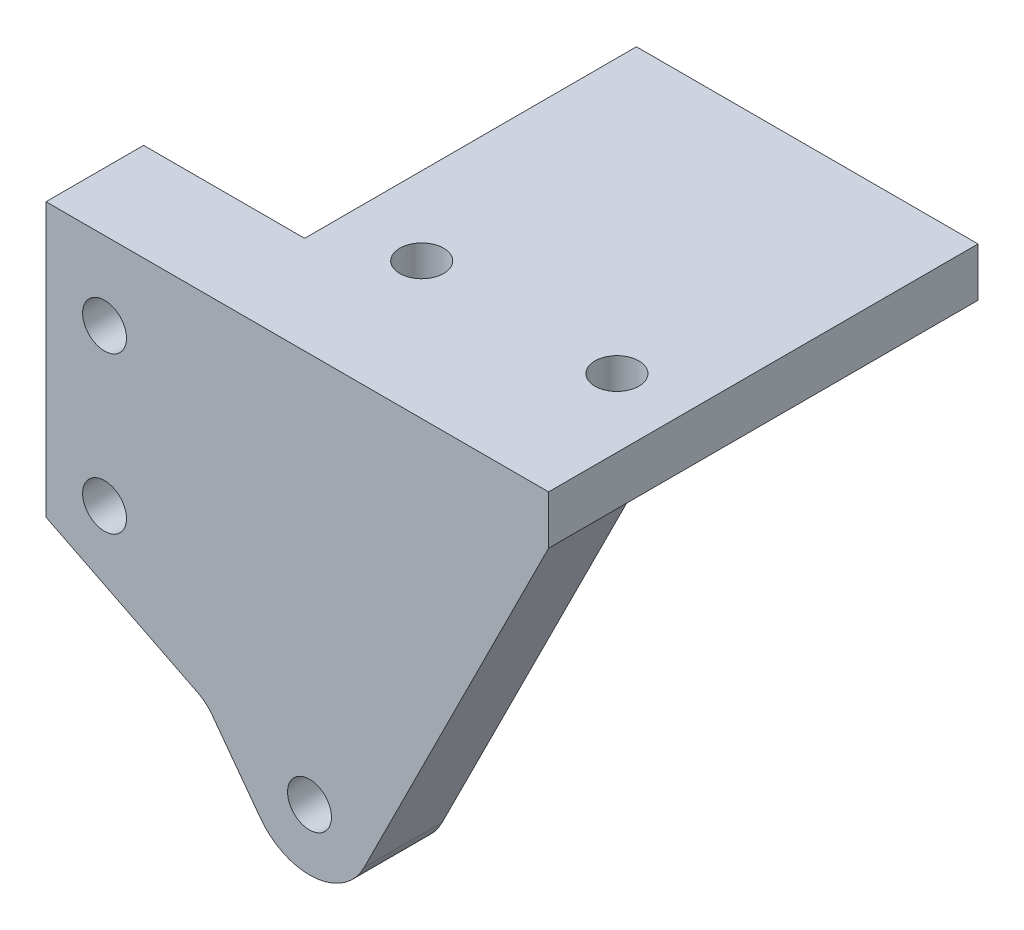
from build123d import *

# Parameters (mm, degrees)
BOSS_EXTRUDE1_DEPTH     = 28
BOSS_EXTRUDE2_DEPTH     = 12
SKETCH3_R               = 2.25
CUT_EXTRUDE1_DEPTH      = 62.565006294
SKETCH4_R               = 2.25
CUT_EXTRUDE2_DEPTH      = 56.554027757
SKETCH5_W               = 40
SKETCH5_H               = 5
BOSS_EXTRUDE3_DEPTH     = 25
CUT_EXTRUDE3_DEPTH      = 10
CUT_EXTRUDE3_DEPTH_BACK = 54.209491634
SKETCH6_R               = 2.25
SKETCH7_W               = 7
SKETCH7_H               = 5
CUT_EXTRUDE4_DEPTH      = 10
SKETCH8_R               = 2.25
BOSS_EXTRUDE4_DEPTH     = 8
BOSS_EXTRUDE6_DEPTH     = 4
SKETCH10_W              = 8
SKETCH10_H              = 28
CUT_EXTRUDE5_DEPTH      = 66.423619588


with BuildPart() as part:
    # Sketch1 → Boss-Extrude1 (new body)
    with BuildSketch(Plane(origin=(0, 0, 0), x_dir=(1, 0, 0), z_dir=(0, 1, 0))):
        Polygon((0, 0), (-26.5, 0), (-26.5, 10), (-10, 10), (-10, 40), (0, 40), align=None)
    extrude(amount=BOSS_EXTRUDE1_DEPTH)

    # Sketch2 → Boss-Extrude2 (add)
    with BuildSketch(Plane.ZY.offset(26.5)):
        with BuildLine():
            Line((0, 28), (0, 0))
            Line((0, 0), (8, 0))
            Line((8, 0), (8, 8))
            ThreePointArc((8, 8), (4, 12), (8, 16))
            Line((8, 16), (8, 28))
            Line((8, 28), (0, 28))
        make_face()
    extrude(amount=-BOSS_EXTRUDE2_DEPTH)

    # Sketch3 → Cut-Extrude1 (cut, through all)
    with BuildSketch(Plane.XY.offset(8)):
        with Locations((-20.5, 20)):
            Circle(SKETCH3_R)
        with Locations((-20.5, 4)):
            Circle(SKETCH3_R)
    extrude(amount=-CUT_EXTRUDE1_DEPTH, mode=Mode.SUBTRACT)

    # Sketch4 → Cut-Extrude2 (cut, through all)
    with BuildSketch(Plane(origin=(0, 0, 0), x_dir=(0, 0, -1), z_dir=(1, 0, 0))):
        with Locations((34, 17.5)):
            Circle(SKETCH4_R)
    extrude(amount=-CUT_EXTRUDE2_DEPTH, mode=Mode.SUBTRACT)

    # Sketch5 → Boss-Extrude3 (add)
    with BuildSketch(Plane(origin=(0, 0, 0), x_dir=(0, 0, -1), z_dir=(1, 0, 0))):
        with Locations((20, 25.5)):
            Rectangle(SKETCH5_W, SKETCH5_H)
    extrude(amount=BOSS_EXTRUDE3_DEPTH)

    # Sketch6 → Cut-Extrude3 (cut, two sides: drawn at the far end of the back side and taken through both)
    with BuildSketch(Plane.XZ.offset(-23).offset(-CUT_EXTRUDE3_DEPTH_BACK)):
        with Locations(Location((-2, -14, 0), (0, 0, 332.733955549))):
            Circle(SKETCH6_R)
        with Locations(Location((18, -14, 0), (0, 0, 90))):
            Circle(SKETCH6_R)
    extrude(amount=CUT_EXTRUDE3_DEPTH + CUT_EXTRUDE3_DEPTH_BACK, mode=Mode.SUBTRACT)

    # Sketch7 → Cut-Extrude4 (cut)
    with BuildSketch(Plane(origin=(0, 0, 0), x_dir=(0, 0, -1), z_dir=(1, 0, 0))):
        with Locations((14, 20.5)):
            Rectangle(SKETCH7_W, SKETCH7_H)
    extrude(amount=-CUT_EXTRUDE4_DEPTH, mode=Mode.SUBTRACT)

    # Sketch8 → Boss-Extrude4 (add)
    with BuildSketch(Plane.XY):
        with BuildLine():
            Line((-9.5, -9), (-4.52228171, -15.720105701))
            ThreePointArc((-4.52228171, -15.720105701), (1.041905897, -18.22646272), (6.089442895, -14.796538598))
            Line((6.089442895, -14.796538598), (25, 23))
            Line((25, 23), (0, 23))
            Line((0, 23), (0, 0))
            Line((0, 0), (-26.5, 0))
            Line((-26.5, 0), (-10.922493011, -7.804616818))
            ThreePointArc((-10.922493011, -7.804616818), (-10.14087473, -8.318566759), (-9.5, -9))
        make_face()
        with Locations((0.5, -12)):
            Circle(SKETCH8_R, mode=Mode.SUBTRACT)
    extrude(amount=-BOSS_EXTRUDE4_DEPTH)

    # Sketch9 → Boss-Extrude6 (add)
    with BuildSketch(Plane(origin=(0, 0, -40), x_dir=(-1, 0, 0), z_dir=(0, 0, -1))):
        Polygon((-25, 23), (0, 0), (10, 0), (10, 28), (-25, 28), align=None)
    extrude(amount=BOSS_EXTRUDE6_DEPTH)

    # Sketch10 → Cut-Extrude5 (cut, through all)
    with BuildSketch(Plane(origin=(-14.5, 0, 0), x_dir=(0, 0, -1), z_dir=(1, 0, 0))):
        with Locations((-4, 14)):
            Rectangle(SKETCH10_W, SKETCH10_H)
    extrude(amount=-CUT_EXTRUDE5_DEPTH, mode=Mode.SUBTRACT)


solid = part.part
